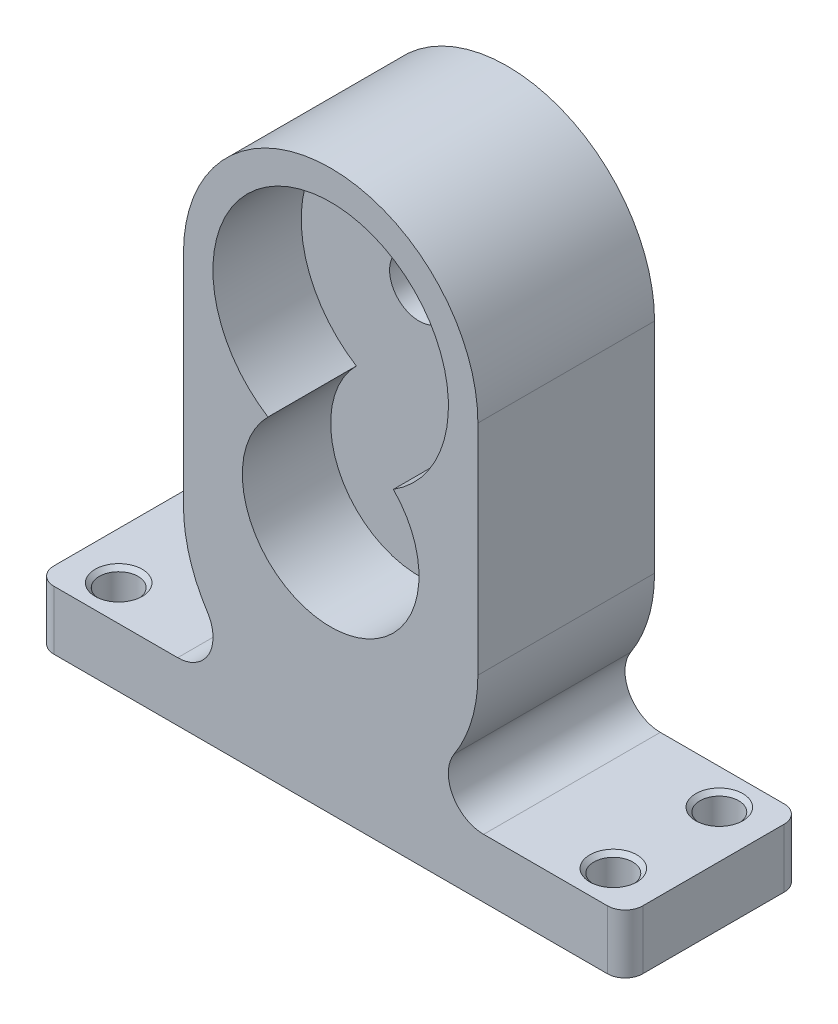
from build123d import *

# Parameters (mm, degrees)
EXTRUDE_1_DEPTH             = 30
SKETCH_5_R                  = 20
CUT_EXTRUDE_1_DEPTH         = 15
SKETCH_6_R                  = 5
CUT_EXTRUDE_2_DEPTH         = 109.397416943
FILLET_1_R                  = 6
SKETCH_7_R                  = 15
CUT_EXTRUDE_3_DEPTH         = 15
HOLE_WIZARD_M62_D           = 6.6
HOLE_WIZARD_M62_CSINK_D     = 8
HOLE_WIZARD_M62_CSINK_ANGLE = 90
PATTERN_LINEAR_1_COUNT      = 2
PATTERN_LINEAR_1_PITCH      = 18
PATTERN_LINEAR_1_COUNT_DIR2 = 2
PATTERN_LINEAR_1_PITCH_DIR2 = 84
FILLET_2_R                  = 3


with BuildPart() as part:
    # Эскиз4 → Бобышка-Вытянуть1 (new body)
    with BuildSketch(Plane.XY):
        with BuildLine():
            Line((0, 0), (50, 0))
            Line((50, 0), (50, 10))
            Line((50, 10), (10, 10))
            ThreePointArc((10, 10), (20.916500663, 19.219814537), (25, 32.912878475))
            Line((25, 32.912878475), (25, 70))
            ThreePointArc((25, 70), (17.67766953, 87.67766953), (0, 95))
            Line((0, 95), (0, 0))
        make_face()
    extrude_1 = extrude(amount=-EXTRUDE_1_DEPTH)

    # Зеркальное отражение1: Бобышка-Вытянуть1 across plane
    add(extrude_1.mirror(Plane(origin=(0, 0, -30), x_dir=(0, 0, 1), z_dir=(-1, 0, 0))))

    # Эскиз5 → Вырез-Вытянуть1 (cut)
    with BuildSketch(Plane.XY):
        with Locations((0, 70)):
            Circle(SKETCH_5_R)
    extrude(amount=-CUT_EXTRUDE_1_DEPTH, mode=Mode.SUBTRACT)

    # Эскиз6 → Вырез-Вытянуть2 (cut, through all)
    with BuildSketch(Plane.XY.offset(-15)):
        with Locations((0, 70)):
            Circle(SKETCH_6_R)
    extrude(amount=-CUT_EXTRUDE_2_DEPTH, mode=Mode.SUBTRACT)

    # Скругление1
    fillet_1_edges = [part.edges().sort_by_distance(p)[0] for p in [
        (10, 10, -15),
        (-10, 10, -15),
    ]]
    fillet(fillet_1_edges, radius=FILLET_1_R)

    # Эскиз7 → Вырез-Вытянуть3 (cut)
    with BuildSketch(Plane.XY):
        with Locations((0, 42.5)):
            Circle(SKETCH_7_R)
    extrude(amount=-CUT_EXTRUDE_3_DEPTH, mode=Mode.SUBTRACT)

    # Зенковка для винта с полупотайной головкой M62 (through all)
    with Locations(Plane(origin=(42, 10, -24), x_dir=(1, 0, 0), z_dir=(0, 1, 0))):
        with Locations((0, 0)):
            hole_wizard_m62 = CounterSinkHole(HOLE_WIZARD_M62_D / 2, HOLE_WIZARD_M62_CSINK_D / 2, counter_sink_angle=HOLE_WIZARD_M62_CSINK_ANGLE)

    # Линейный массив1: Hole Wizard M62 2 × 2
    with Locations(*[(-j * PATTERN_LINEAR_1_PITCH_DIR2, 0, i * PATTERN_LINEAR_1_PITCH) for i in range(PATTERN_LINEAR_1_COUNT) for j in range(PATTERN_LINEAR_1_COUNT_DIR2) if (i, j) != (0, 0)]):
        add(hole_wizard_m62, mode=Mode.SUBTRACT)

    # Скругление2
    fillet_2_edges = [part.edges().sort_by_distance(p)[0] for p in [
        (50, 5, -30),
        (-50, 5, 0),
        (-50, 5, -30),
        (50, 5, 0),
    ]]
    fillet(fillet_2_edges, radius=FILLET_2_R)


solid = part.part
